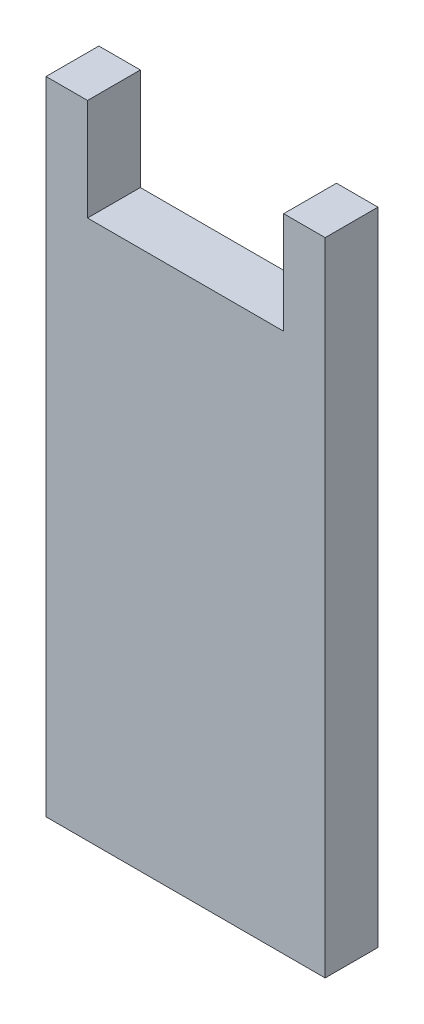
from build123d import *

# Parameters (mm, degrees)
BOSS_EXTRUDE1_DEPTH = 7


with BuildPart() as part:
    # Sketch1 → Boss-Extrude1 (new body)
    with BuildSketch(Plane.XY):
        Polygon((14.5, 67.260869565), (14.5, 80.760869565), (20, 80.760869565), (20, -4.239130435), (-17, -4.239130435), (-17, 80.760869565), (-11.5, 80.760869565), (-11.5, 67.260869565), align=None)
    extrude(amount=-BOSS_EXTRUDE1_DEPTH)


solid = part.part
